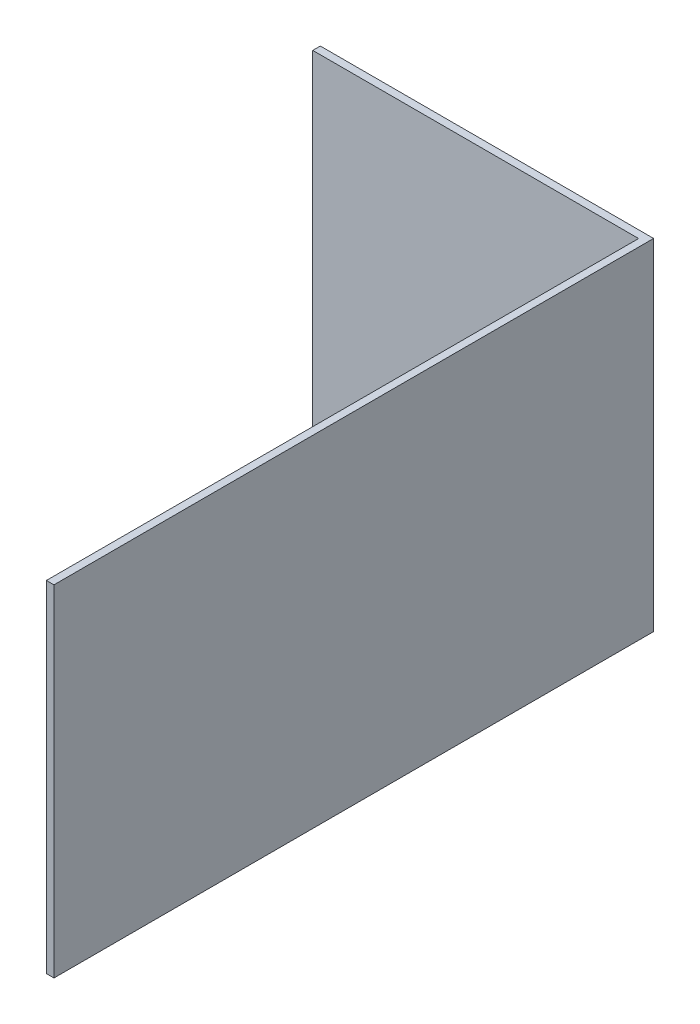
from build123d import *

# Parameters (mm, degrees)
BOSS_EXTRUDE1_DEPTH = 674.135566945


with BuildPart() as part:
    # Sketch1 → Boss-Extrude1 (new body)
    with BuildSketch(Plane(origin=(0, 0, 0), x_dir=(1, 0, 0), z_dir=(0, 1, 0))):
        Polygon((345.31088599, -749.286342906), (345.31088599, 423.210637315), (-299.880046862, 423.210637315), (-299.880046862, 438.210637314), (360, 438.210637314), (360.31088599, -749.286342906), align=None)
    extrude(amount=BOSS_EXTRUDE1_DEPTH)


solid = part.part
